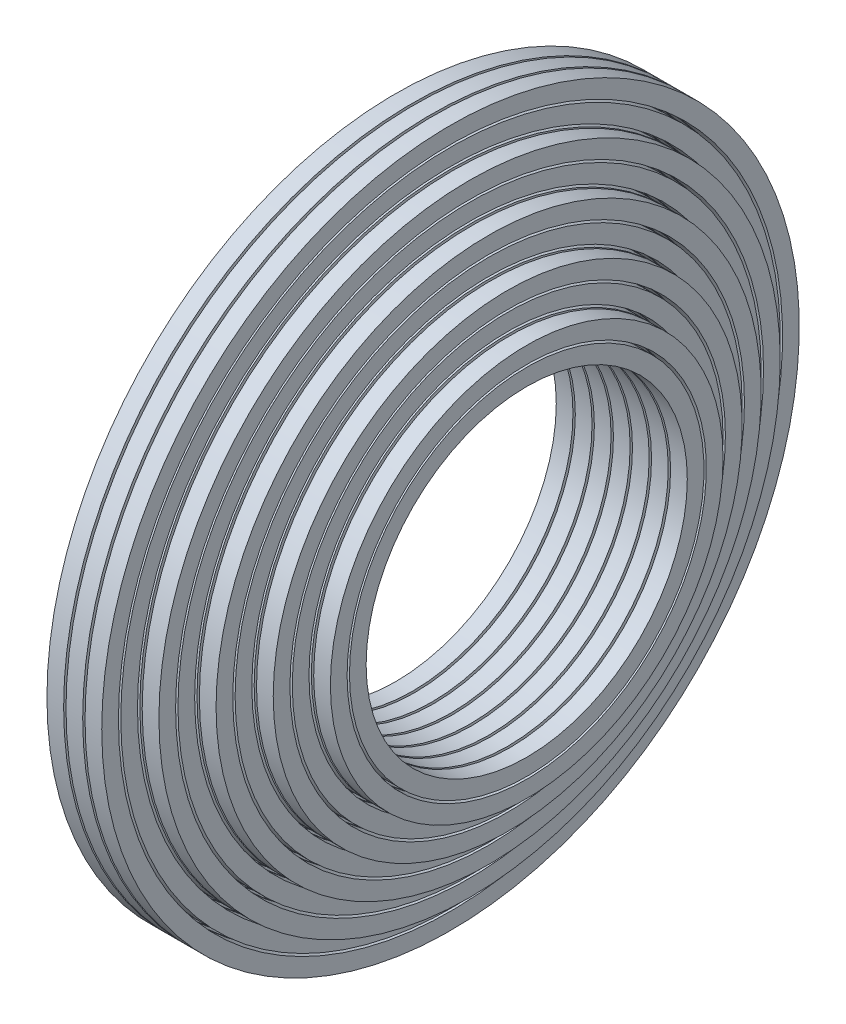
from build123d import *

# Parameters (mm, degrees)
SKETCH1_W = 3.4
SKETCH1_H = 3.4


with BuildPart() as part:
    # Sketch1 → Revolve2 (revolve)
    with BuildSketch(Plane.XY, mode=Mode.PRIVATE) as revolve2_sk:
        with Locations((11.47304498, 34.4)):
            Rectangle(SKETCH1_W, SKETCH1_H)
        with Locations((7.59304498, 34.4)):
            Rectangle(SKETCH1_W, SKETCH1_H)
        with Locations((15.35304498, 34.4)):
            Rectangle(SKETCH1_W, SKETCH1_H)
        with Locations((19.23304498, 34.4)):
            Rectangle(SKETCH1_W, SKETCH1_H)
        with Locations((23.11304498, 34.4)):
            Rectangle(SKETCH1_W, SKETCH1_H)
        with Locations((26.99304498, 34.4)):
            Rectangle(SKETCH1_W, SKETCH1_H)
        with Locations((30.87304498, 34.4)):
            Rectangle(SKETCH1_W, SKETCH1_H)
        with Locations((7.59304498, 38.28)):
            Rectangle(SKETCH1_W, SKETCH1_H)
        with Locations((11.47304498, 38.28)):
            Rectangle(SKETCH1_W, SKETCH1_H)
        with Locations((15.35304498, 38.28)):
            Rectangle(SKETCH1_W, SKETCH1_H)
        with Locations((19.23304498, 38.28)):
            Rectangle(SKETCH1_W, SKETCH1_H)
        with Locations((23.11304498, 38.28)):
            Rectangle(SKETCH1_W, SKETCH1_H)
        with Locations((26.99304498, 38.28)):
            Rectangle(SKETCH1_W, SKETCH1_H)
        with Locations((30.87304498, 38.28)):
            Rectangle(SKETCH1_W, SKETCH1_H)
        with Locations((7.59304498, 42.16)):
            Rectangle(SKETCH1_W, SKETCH1_H)
        with Locations((11.47304498, 42.16)):
            Rectangle(SKETCH1_W, SKETCH1_H)
        with Locations((15.35304498, 42.16)):
            Rectangle(SKETCH1_W, SKETCH1_H)
        with Locations((19.23304498, 42.16)):
            Rectangle(SKETCH1_W, SKETCH1_H)
        with Locations((23.11304498, 42.16)):
            Rectangle(SKETCH1_W, SKETCH1_H)
        with Locations((26.99304498, 42.16)):
            Rectangle(SKETCH1_W, SKETCH1_H)
        with Locations((7.59304498, 46.04)):
            Rectangle(SKETCH1_W, SKETCH1_H)
        with Locations((11.47304498, 46.04)):
            Rectangle(SKETCH1_W, SKETCH1_H)
        with Locations((15.35304498, 46.04)):
            Rectangle(SKETCH1_W, SKETCH1_H)
        with Locations((19.23304498, 46.04)):
            Rectangle(SKETCH1_W, SKETCH1_H)
        with Locations((23.11304498, 46.04)):
            Rectangle(SKETCH1_W, SKETCH1_H)
        with Locations((26.99304498, 46.04)):
            Rectangle(SKETCH1_W, SKETCH1_H)
        with Locations((7.59304498, 49.92)):
            Rectangle(SKETCH1_W, SKETCH1_H)
        with Locations((11.47304498, 49.92)):
            Rectangle(SKETCH1_W, SKETCH1_H)
        with Locations((15.35304498, 49.92)):
            Rectangle(SKETCH1_W, SKETCH1_H)
        with Locations((19.23304498, 49.92)):
            Rectangle(SKETCH1_W, SKETCH1_H)
        with Locations((23.11304498, 49.92)):
            Rectangle(SKETCH1_W, SKETCH1_H)
        with Locations((7.59304498, 53.8)):
            Rectangle(SKETCH1_W, SKETCH1_H)
        with Locations((11.47304498, 53.8)):
            Rectangle(SKETCH1_W, SKETCH1_H)
        with Locations((15.35304498, 53.8)):
            Rectangle(SKETCH1_W, SKETCH1_H)
        with Locations((19.23304498, 53.8)):
            Rectangle(SKETCH1_W, SKETCH1_H)
        with Locations((23.11304498, 53.8)):
            Rectangle(SKETCH1_W, SKETCH1_H)
        with Locations((7.59304498, 57.68)):
            Rectangle(SKETCH1_W, SKETCH1_H)
        with Locations((11.47304498, 57.68)):
            Rectangle(SKETCH1_W, SKETCH1_H)
        with Locations((15.35304498, 57.68)):
            Rectangle(SKETCH1_W, SKETCH1_H)
        with Locations((19.23304498, 57.68)):
            Rectangle(SKETCH1_W, SKETCH1_H)
        with Locations((7.59304498, 61.56)):
            Rectangle(SKETCH1_W, SKETCH1_H)
        with Locations((11.47304498, 61.56)):
            Rectangle(SKETCH1_W, SKETCH1_H)
        with Locations((15.35304498, 61.56)):
            Rectangle(SKETCH1_W, SKETCH1_H)
        with Locations((19.23304498, 61.56)):
            Rectangle(SKETCH1_W, SKETCH1_H)
        with Locations((7.59304498, 65.44)):
            Rectangle(SKETCH1_W, SKETCH1_H)
        with Locations((11.47304498, 65.44)):
            Rectangle(SKETCH1_W, SKETCH1_H)
        with Locations((15.35304498, 65.44)):
            Rectangle(SKETCH1_W, SKETCH1_H)
        with Locations((7.59304498, 69.32)):
            Rectangle(SKETCH1_W, SKETCH1_H)
        with Locations((11.47304498, 69.32)):
            Rectangle(SKETCH1_W, SKETCH1_H)
        with Locations((15.35304498, 69.32)):
            Rectangle(SKETCH1_W, SKETCH1_H)
    revolve(revolve2_sk.sketch.rotate(Axis((0, 0, 0), (1, 0, 0)), 90), axis=Axis((0, 0, 0), (1, 0, 0)))


solid = part.part
